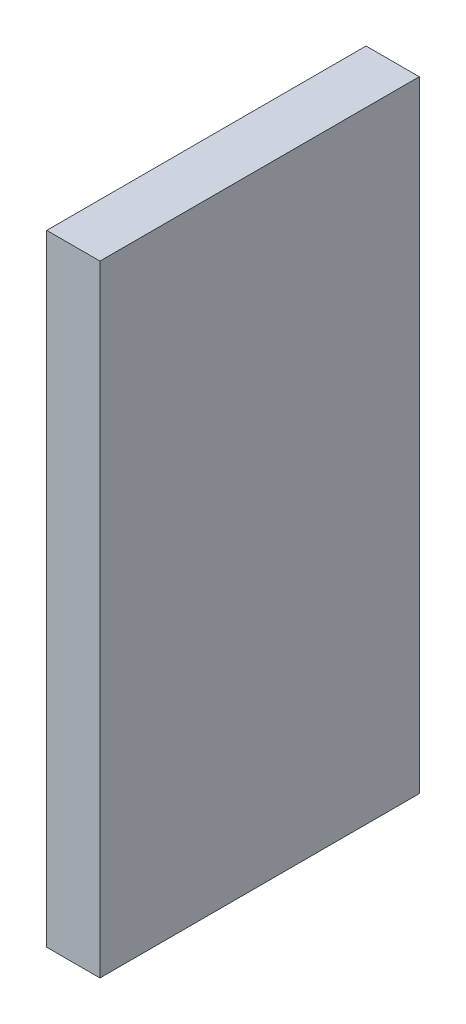
from build123d import *

# Parameters (mm, degrees)
SKETCH1_W           = 18
SKETCH1_H           = 35
BOSS_EXTRUDE1_DEPTH = 3


with BuildPart() as part:
    # Sketch1 → Boss-Extrude1 (new body)
    with BuildSketch(Plane(origin=(0, 0, 0), x_dir=(0, 0, -1), z_dir=(1, 0, 0))):
        Rectangle(SKETCH1_W, SKETCH1_H)
    extrude(amount=BOSS_EXTRUDE1_DEPTH)


solid = part.part
